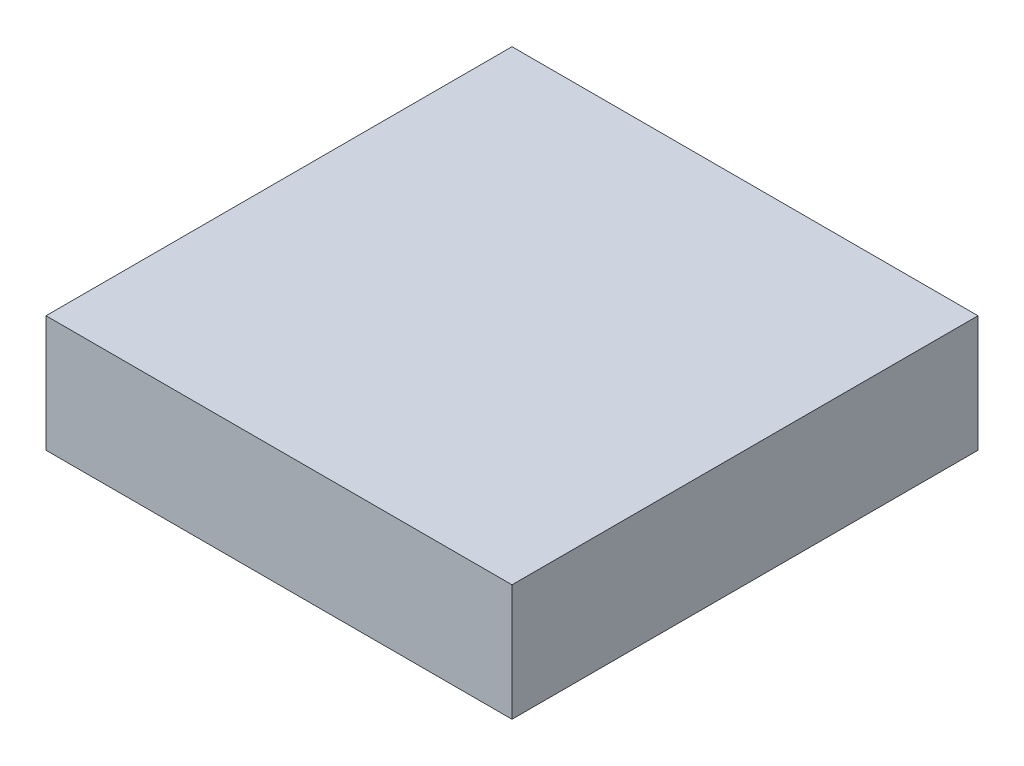
from build123d import *

# Parameters (mm, degrees)
SKETCH1_W           = 25.4
SKETCH1_H           = 25.4
BOSS_EXTRUDE1_DEPTH = 6.35


with BuildPart() as part:
    # Sketch1 → Boss-Extrude1 (new body)
    with BuildSketch(Plane(origin=(0, 0, 0), x_dir=(1, 0, 0), z_dir=(0, 1, 0))):
        with Locations((-15.844761905, 1.20952381)):
            Rectangle(SKETCH1_W, SKETCH1_H)
    extrude(amount=BOSS_EXTRUDE1_DEPTH)


solid = part.part
